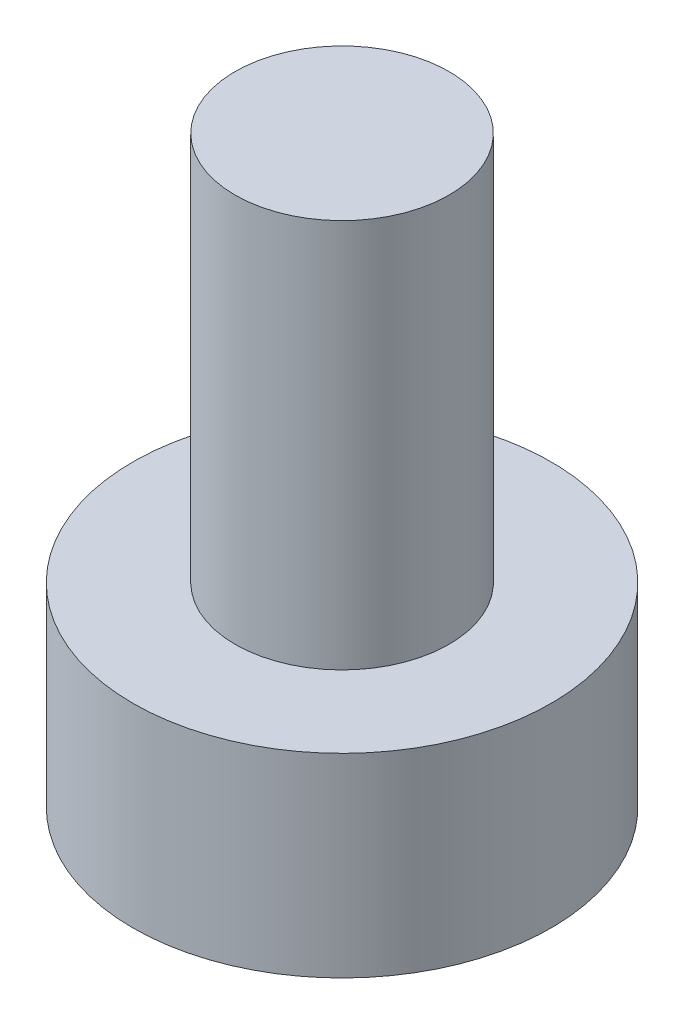
from build123d import *

# Parameters (mm, degrees)
SKETCH1_R           = 2.15
BOSS_EXTRUDE1_DEPTH = 2
SKETCH2_R           = 1.1
BOSS_EXTRUDE2_DEPTH = 4


with BuildPart() as part:
    # Sketch1 → Boss-Extrude1 (new body)
    with BuildSketch(Plane(origin=(0, 0, 0), x_dir=(1, 0, 0), z_dir=(0, 1, 0))):
        with Locations(Location((0, 0, 0), (0, 0, 270))):
            Circle(SKETCH1_R)
    extrude(amount=BOSS_EXTRUDE1_DEPTH)

    # Sketch2 → Boss-Extrude2 (add)
    with BuildSketch(Plane(origin=(0, 2, 0), x_dir=(1, 0, 0), z_dir=(0, 1, 0))):
        with Locations(Location((0, 0, 0), (0, 0, 270))):
            Circle(SKETCH2_R)
    extrude(amount=BOSS_EXTRUDE2_DEPTH)


solid = part.part
